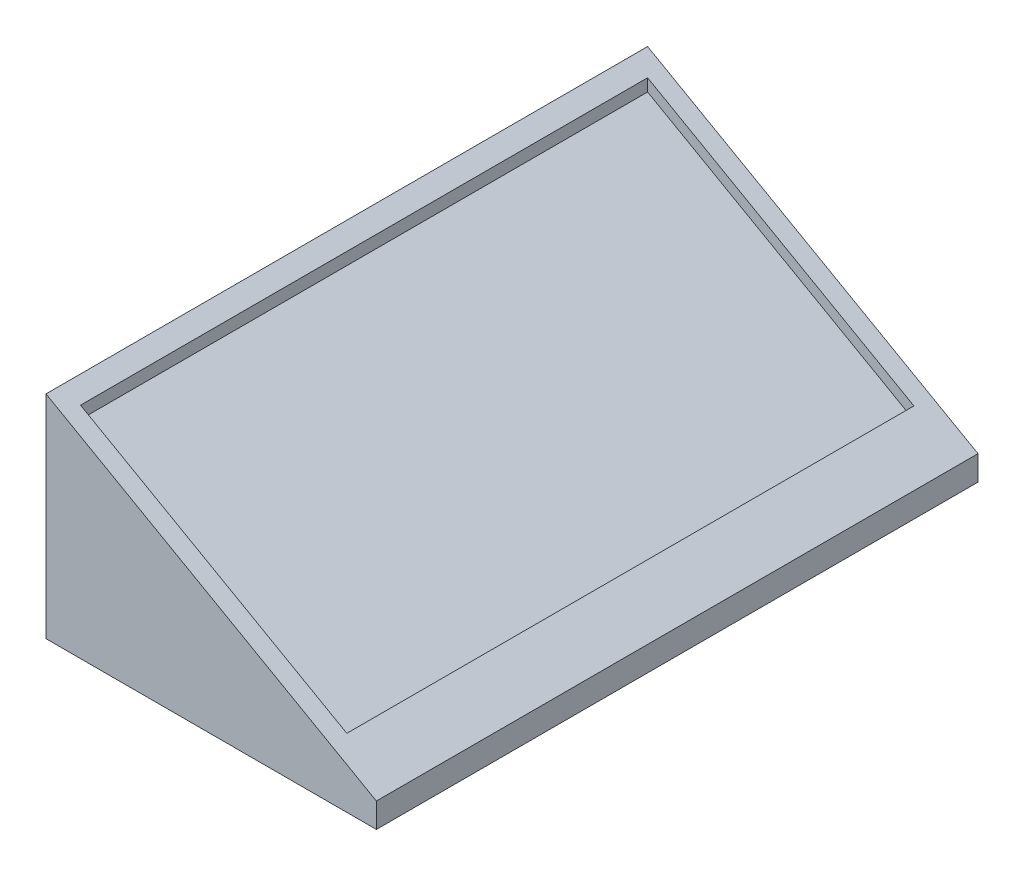
from build123d import *

# Parameters (mm, degrees)
BOSS_EXTRUDE1_DEPTH = 122
SKETCH3_W           = 60.039506293
SKETCH3_H           = 115
CUT_EXTRUDE1_DEPTH  = 122
BOSS_EXTRUDE3_DEPTH = 116.5
BOSS_EXTRUDE4_DEPTH = 116.5
BOSS_EXTRUDE5_DEPTH = 116.5
SKETCH10_W          = 63
SKETCH10_H          = 2
BOSS_EXTRUDE6_DEPTH = 5


with BuildPart() as part:
    # Sketch1 → Boss-Extrude1 (new body)
    with BuildSketch(Plane.XY):
        Polygon((0, 0), (67, 0), (0, 38), align=None)
    extrude(amount=BOSS_EXTRUDE1_DEPTH)

    # Sketch3 → Cut-Extrude1 (cut)
    with BuildSketch(Plane.XZ):
        with Locations((33.519753147, 61)):
            Rectangle(SKETCH3_W, SKETCH3_H)
    extrude(amount=-CUT_EXTRUDE1_DEPTH, mode=Mode.SUBTRACT)

    # Sketch4 → Boss-Extrude3 (add)
    with BuildSketch(Plane(origin=(0, 0, 118.5), x_dir=(-1, 0, 0), z_dir=(0, 0, -1))):
        Polygon((-3.5, 33.514925373), (-3.5, 30.640822028), (-57.429863124, 0.05373548), (-57.429863124, 2.927838825), align=None)
    extrude(amount=BOSS_EXTRUDE3_DEPTH)

    # Sketch6 → Boss-Extrude4 (add)
    with BuildSketch(Plane(origin=(0, 0, 118.5), x_dir=(-1, 0, 0), z_dir=(0, 0, -1))):
        Polygon((-57.429863124, 2.927838825), (-58.502676203, 4.819377676), (-63.539506293, 1.962668073), (-63.539506293, 0), (-57.429863124, 0.05373548), align=None)
    extrude(amount=BOSS_EXTRUDE4_DEPTH)

    # Sketch9 → Boss-Extrude5 (add)
    with BuildSketch(Plane.XY.offset(3.5)):
        Polygon((58.502676203, 4.819377676), (57.502676203, 5.386541855), (56.429863124, 3.495003005), (57.429863124, 2.927838825), align=None)
    extrude(amount=BOSS_EXTRUDE5_DEPTH)

    # Sketch10 → Boss-Extrude6 (add)
    with BuildSketch(Plane.XZ):
        Polygon((0, 122), (0, 0), (2, 0), (2, 2), (2, 120), (2, 122), align=None)
        Polygon((67, 122), (2, 122), (2, 120), (65, 120), (67, 120), align=None)
        with Locations((33.5, 1)):
            Rectangle(SKETCH10_W, SKETCH10_H)
        Polygon((65, 2), (65, 0), (67, 0), (67, 120), (65, 120), align=None)
    extrude(amount=BOSS_EXTRUDE6_DEPTH)


solid = part.part
